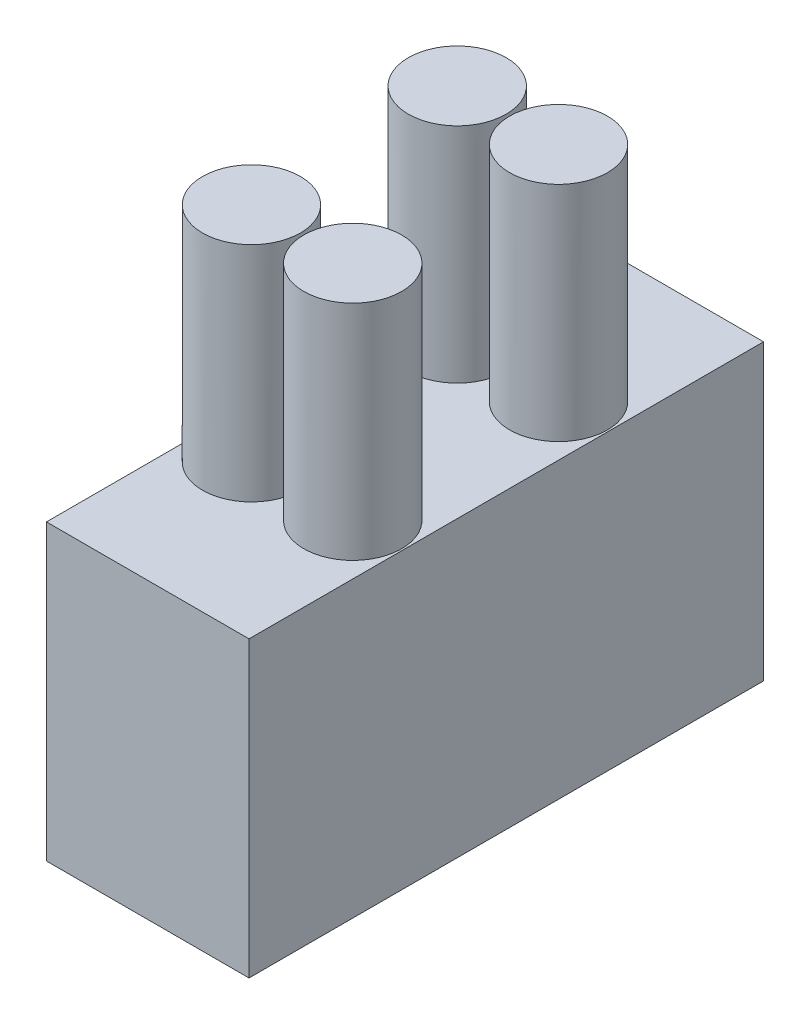
from build123d import *

# Parameters (mm, degrees)
SKETCH1_W           = 6
SKETCH1_H           = 15.24
BOSS_EXTRUDE1_DEPTH = 8.7
SKETCH2_R           = 1.45
BOSS_EXTRUDE2_DEPTH = 6.6


with BuildPart() as part:
    # Sketch1 → Boss-Extrude1 (new body)
    with BuildSketch(Plane(origin=(0, 0, 0), x_dir=(1, 0, 0), z_dir=(0, 1, 0))):
        with Locations((3, 7.62)):
            Rectangle(SKETCH1_W, SKETCH1_H)
    extrude(amount=BOSS_EXTRUDE1_DEPTH)

    # Sketch2 → Boss-Extrude2 (add)
    with BuildSketch(Plane(origin=(0, 8.7, 0), x_dir=(1, 0, 0), z_dir=(0, 1, 0))):
        with Locations(Location((1.5, 10.668, 0), (0, 0, 90))):
            Circle(SKETCH2_R)
        with Locations(Location((1.5, 4.572, 0), (0, 0, 90))):
            Circle(SKETCH2_R)
        with Locations(Location((4.5, 4.572, 0), (0, 0, 90))):
            Circle(SKETCH2_R)
        with Locations(Location((4.5, 10.668, 0), (0, 0, 90))):
            Circle(SKETCH2_R)
    extrude(amount=BOSS_EXTRUDE2_DEPTH)


solid = part.part
